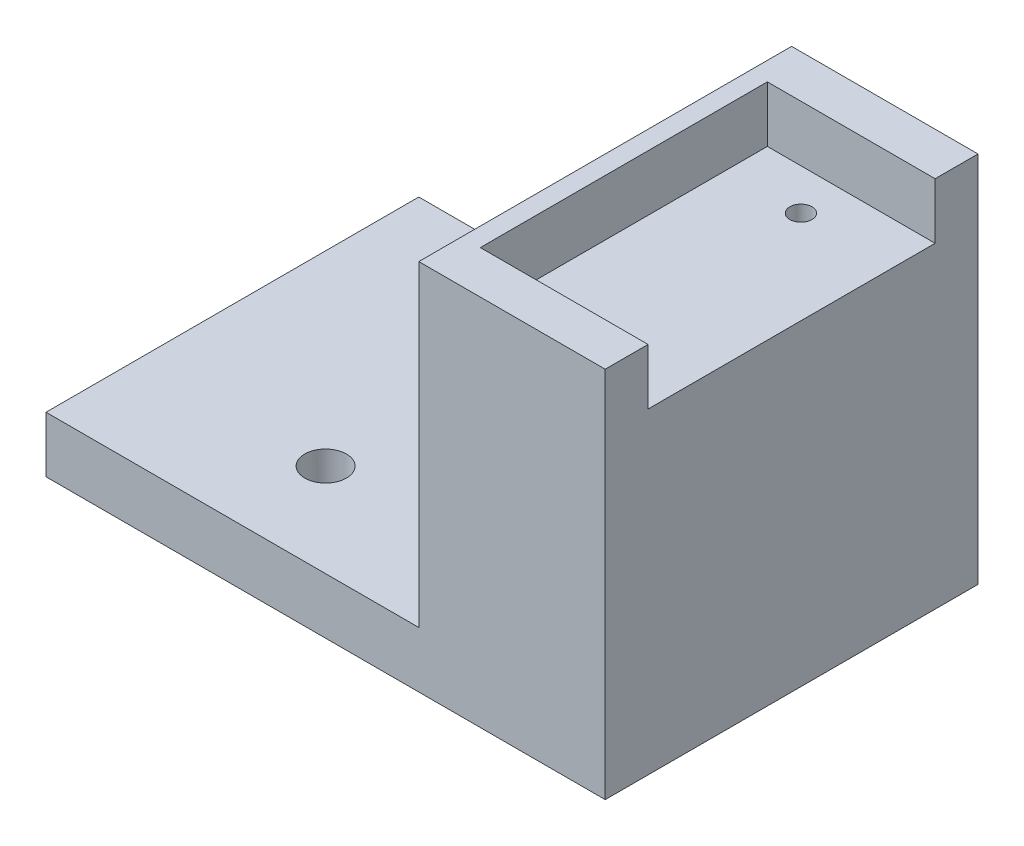
from build123d import *

# Parameters (mm, degrees)
SKETCH1_W                 = 25.4
SKETCH1_H                 = 25.4
BOSS_EXTRUDE1_DEPTH       = 12.7
SKETCH2_W                 = 11.43
SKETCH2_H                 = 19.558
CUT_EXTRUDE1_DEPTH        = 3.81
SHELL2_T                  = -5.08
F_1_64_TAPPED_HOLE2_D     = 1.5113
F_1_64_TAPPED_HOLE2_DEPTH = 6.35
F_1_64_TAPPED_HOLE2_TIP   = 0.454040327
SKETCH12_W                = 38.1
SKETCH12_H                = 25.4
BOSS_EXTRUDE2_DEPTH       = 3.81
SKETCH16_R                = 1.4224
CUT_EXTRUDE2_DEPTH        = 44.994090512


with BuildPart() as part:
    # Sketch1 → Boss-Extrude1 (new body)
    with BuildSketch(Plane(origin=(0, 0, 0), x_dir=(0, 0, -1), z_dir=(1, 0, 0))):
        with Locations((12.7, 12.7)):
            Rectangle(SKETCH1_W, SKETCH1_H)
    extrude(amount=BOSS_EXTRUDE1_DEPTH)

    # Sketch2 → Cut-Extrude1 (cut)
    with BuildSketch(Plane(origin=(0, 25.4, 0), x_dir=(1, 0, 0), z_dir=(0, 1, 0))):
        with Locations((6.985, 12.7)):
            Rectangle(SKETCH2_W, SKETCH2_H)
    extrude(amount=-CUT_EXTRUDE1_DEPTH, mode=Mode.SUBTRACT)

    # Shell2
    shell2_openings = [part.faces().sort_by_distance(p)[0] for p in [
        (6.35, 0, -12.7),
    ]]
    offset(amount=SHELL2_T, openings=shell2_openings, kind=Kind.INTERSECTION)

    # #1-64 Tapped Hole2
    with Locations(Plane(origin=(0, 21.59, 0), x_dir=(1, 0, 0), z_dir=(0, 1, 0))):
        with Locations((6.35, 19.685), (6.35, 5.715)):
            Hole(F_1_64_TAPPED_HOLE2_D / 2, depth=F_1_64_TAPPED_HOLE2_DEPTH)
            with Locations((0, 0, -(F_1_64_TAPPED_HOLE2_DEPTH + F_1_64_TAPPED_HOLE2_TIP / 2))):  # 118° drill point
                Cone(0, F_1_64_TAPPED_HOLE2_D / 2, F_1_64_TAPPED_HOLE2_TIP, mode=Mode.SUBTRACT)

    # Sketch12 → Boss-Extrude2 (add)
    with BuildSketch(Plane.XZ):
        with Locations((-6.35, -12.7)):
            Rectangle(SKETCH12_W, SKETCH12_H)
    extrude(amount=-BOSS_EXTRUDE2_DEPTH)

    # Sketch16 → Cut-Extrude2 (cut, through all)
    with BuildSketch(Plane.XZ):
        with Locations(Location((-12.7, -6.35, 0), (0, 0, 270))):
            Circle(SKETCH16_R)
        with Locations(Location((-12.7, -19.05, 0), (0, 0, 270))):
            Circle(SKETCH16_R)
    extrude(amount=-CUT_EXTRUDE2_DEPTH, mode=Mode.SUBTRACT)


solid = part.part
